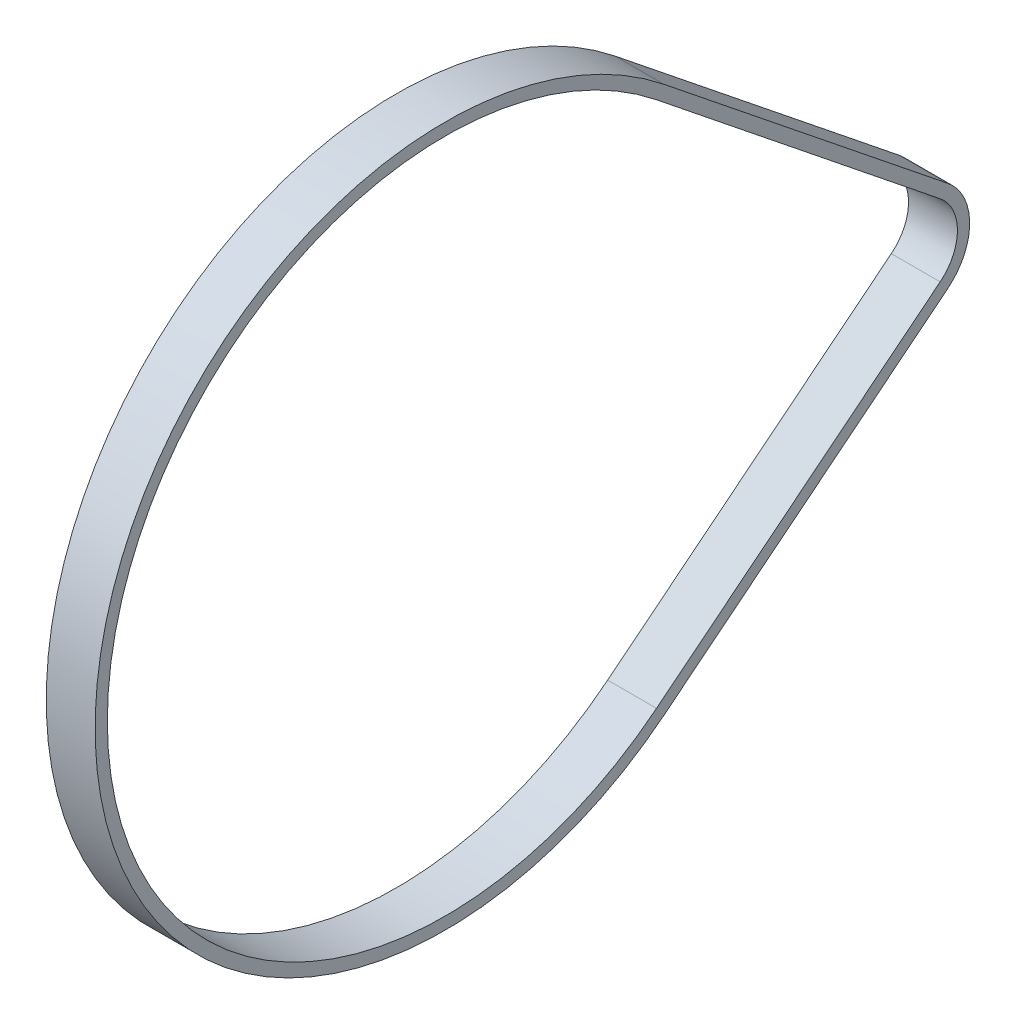
from build123d import *

# Parameters (mm, degrees)
BOSS_EXTRUDE1_DEPTH = 5


with BuildPart() as part:
    # Sketch1 → Boss-Extrude1 (new, symmetric)
    with BuildSketch(Plane(origin=(0, 0, 0), x_dir=(0, 0, -1), z_dir=(1, 0, 0))):
        with BuildLine():
            Line((-2.874697349, 55.865657575), (55.1592415, 9.310942929))
            ThreePointArc((55.1592415, 9.310942929), (59.626641639, 0), (55.1592415, -9.310942929))
            Line((55.1592415, -9.310942929), (-2.874697349, -55.865657575))
            ThreePointArc((-2.874697349, -55.865657575), (-119.309745298, 0), (-2.874697349, 55.865657575))
        make_face()
        with BuildLine():
            Line((-4.439047251, 53.915578248), (53.594891597, 7.360863602))
            ThreePointArc((53.594891597, 7.360863602), (57.126641639, 0), (53.594891597, -7.360863602))
            Line((53.594891597, -7.360863602), (-4.439047251, -53.915578248))
            ThreePointArc((-4.439047251, -53.915578248), (-116.809745298, 0), (-4.439047251, 53.915578248))
        make_face(mode=Mode.SUBTRACT)
    extrude(amount=BOSS_EXTRUDE1_DEPTH, both=True)


solid = part.part
